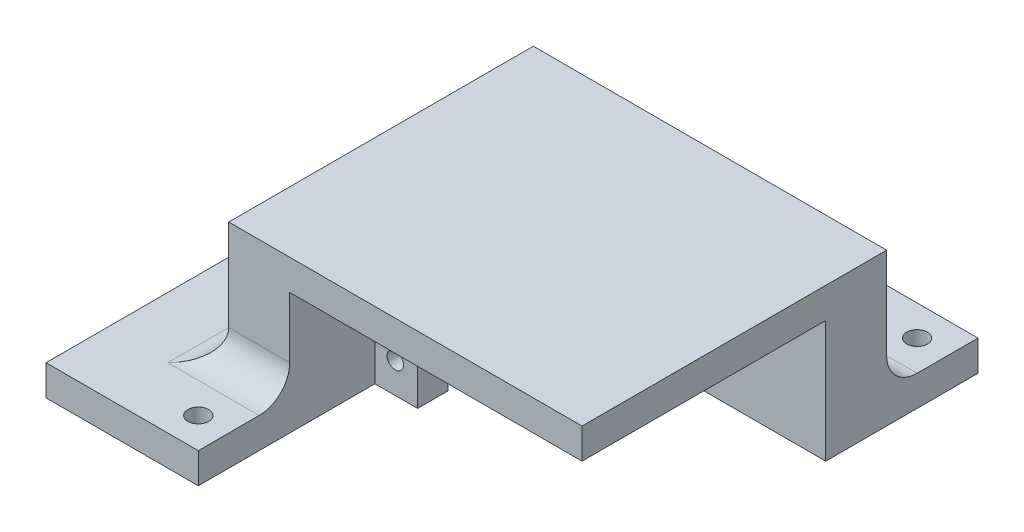
from build123d import *

# Parameters (mm, degrees)
SKETCH_1_W          = 25
SKETCH_1_H          = 55
SKETCH_1_R          = 1.7
SKETCH_1_W_2        = 48
SKETCH_1_H_2        = 25
EXTRUDE_1_DEPTH     = 5
SKETCH_2_W          = 48
SKETCH_2_H          = 10
SKETCH_2_W_2        = 10
SKETCH_2_H_2        = 40
EXTRUDE_2_DEPTH     = 15
SKETCH_3_W          = 58
SKETCH_3_H          = 50
EXTRUDE_3_DEPTH     = 5
SKETCH_4_W          = 5
SKETCH_4_H          = 20
EXTRUDE_4_DEPTH     = 7
SKETCH_5_R          = 1.35
CUT_EXTRUDE_1_DEPTH = 7
FILLET_1_R          = 5


with BuildPart() as part:
    # 草图1 → 凸台-拉伸1 (new body)
    # profile 1 of 3: a face of its own
    with BuildSketch(Plane(origin=(0, 0, 0), x_dir=(1, 0, 0), z_dir=(0, 1, 0))):
        with Locations((-36.5, 0)):
            Rectangle(SKETCH_1_W, SKETCH_1_H)
        with Locations(Location((-29, -22.5, 0), (0, 0, 270))):
            Circle(SKETCH_1_R, mode=Mode.SUBTRACT)
    # profile 2 of 3: a face of its own
    with BuildSketch(Plane(origin=(0, 0, 0), x_dir=(1, 0, 0), z_dir=(0, 1, 0))):
        with Locations((0, 40)):
            Rectangle(SKETCH_1_W_2, SKETCH_1_H_2)
        with Locations(Location((19, 47.5, 0), (0, 0, 270))):
            Circle(SKETCH_1_R, mode=Mode.SUBTRACT)
    # profile 3 of 3: a face of its own
    with BuildSketch(Plane(origin=(0, 0, 0), x_dir=(1, 0, 0), z_dir=(0, 1, 0))):
        with Locations((-36.5, 40)):
            Rectangle(SKETCH_1_W, SKETCH_1_H_2)
        with Locations(Location((-44, 47.5, 0), (0, 0, 270))):
            Circle(SKETCH_1_R, mode=Mode.SUBTRACT)
    extrude(amount=EXTRUDE_1_DEPTH)

    # 草图2 → 凸台-拉伸2 (add)
    with BuildSketch(Plane(origin=(0, 5, 0), x_dir=(1, 0, 0), z_dir=(0, 1, 0))):
        with Locations((0, 32.5)):
            Rectangle(SKETCH_2_W, SKETCH_2_H)
        with Locations((-29, 32.5)):
            Rectangle(SKETCH_2_W_2, SKETCH_2_H)
        with Locations((-29, 7.5)):
            Rectangle(SKETCH_2_W_2, SKETCH_2_H_2)
    extrude(amount=EXTRUDE_2_DEPTH)

    # 草图3 → 凸台-拉伸3 (add)
    with BuildSketch(Plane(origin=(0, 20, 0), x_dir=(1, 0, 0), z_dir=(0, 1, 0))):
        with Locations((-5, 12.5)):
            Rectangle(SKETCH_3_W, SKETCH_3_H)
    extrude(amount=EXTRUDE_3_DEPTH)

    # 草图4 → 凸台-拉伸4 (add)
    with BuildSketch(Plane(origin=(-24, 0, 0), x_dir=(0, 0, -1), z_dir=(1, 0, 0))):
        with Locations((4, 10)):
            Rectangle(SKETCH_4_W, SKETCH_4_H)
    extrude(amount=EXTRUDE_4_DEPTH)

    # 草图5 → 切除-拉伸1 (cut)
    with BuildSketch(Plane.XY.offset(-1.5)):
        with Locations((-20.65, 5)):
            Circle(SKETCH_5_R)
        with Locations((-20.65, 15)):
            Circle(SKETCH_5_R)
    extrude(amount=-CUT_EXTRUDE_1_DEPTH, mode=Mode.SUBTRACT)

    # 圆角1
    fillet_1_edges = [part.edges().sort_by_distance(p)[0] for p in [
        (-5, 5, -37.5),
        (-29, 5, 12.5),
        (-34, 5, -12.5),
    ]]
    fillet(fillet_1_edges, radius=FILLET_1_R)


solid = part.part
